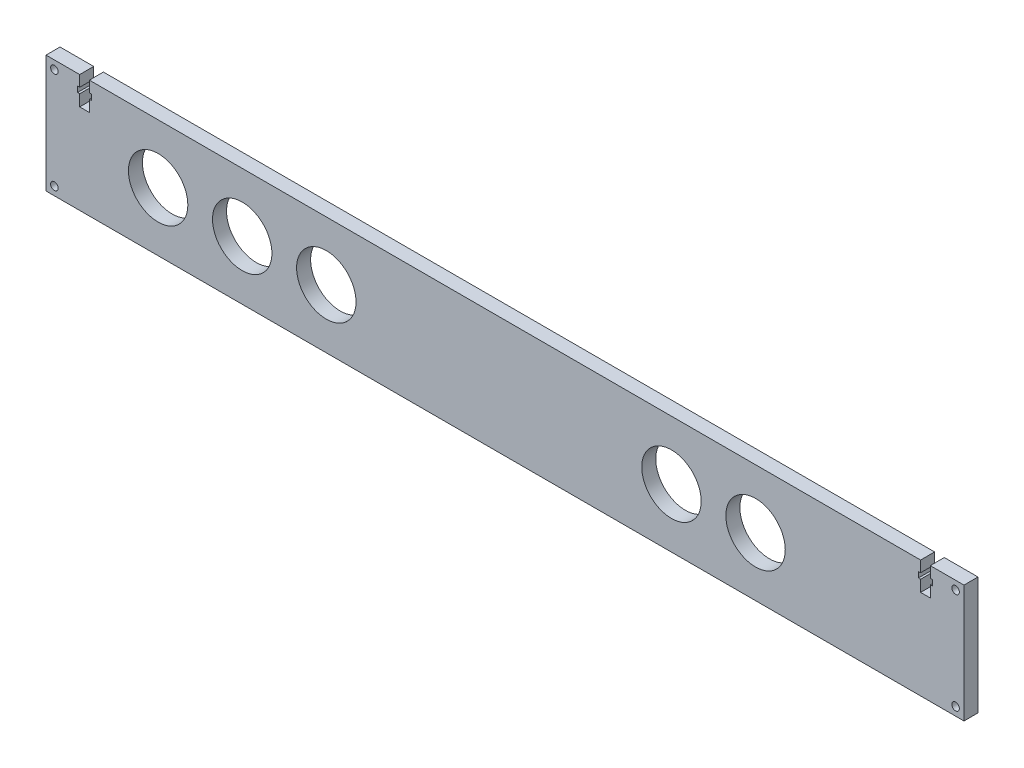
from build123d import *

# Parameters (mm, degrees)
SKETCH1_W                   = 415.925
SKETCH1_H                   = 53.34
BOSS_EXTRUDE1_DEPTH         = 6.35
SKETCH6_R                   = 13.462
CUT_EXTRUDE4_DEPTH          = 502.480799104
F_29_0_136_DIAMETER_HOLE1_D = 3.4544
CUT_EXTRUDE3_DEPTH          = 502.480799104


with BuildPart() as part:
    # Sketch1 → Boss-Extrude1 (new body)
    with BuildSketch(Plane.XY):
        with Locations((-250.890650119, 175.558721987)):
            Rectangle(SKETCH1_W, SKETCH1_H)
    extrude(amount=BOSS_EXTRUDE1_DEPTH)

    # Sketch6 → Cut-Extrude4 (cut, through all)
    with BuildSketch(Plane.XY.offset(6.35)):
        with Locations((-408.053150119, 175.558721987)):
            Circle(SKETCH6_R)
        with Locations((-175.467685368, 175.558721987)):
            Circle(SKETCH6_R)
        with Locations((-369.953150119, 175.558721987)):
            Circle(SKETCH6_R)
        with Locations((-331.853150119, 175.558721987)):
            Circle(SKETCH6_R)
        with Locations((-137.367685368, 175.558721987)):
            Circle(SKETCH6_R)
    extrude(amount=-CUT_EXTRUDE4_DEPTH, mode=Mode.SUBTRACT)

    # #29 (0.136) Diameter Hole1 (through all)
    with Locations(Plane.XY.offset(6.35)):
        with Locations((-455.043150119, 198.418721987), (-455.043150119, 152.698721987), (-46.738150119, 198.418721987), (-46.738150119, 152.698721987)):
            Hole(F_29_0_136_DIAMETER_HOLE1_D / 2)

    # Sketch5 → Cut-Extrude3 (cut, through all)
    with BuildSketch(Plane(origin=(0, 0, 0), x_dir=(-1, 0, 0), z_dir=(0, 0, -1))):
        Polygon((443.587750119, 202.228721987), (439.193550119, 202.228721987), (439.193550119, 197.228096987), (438.215650119, 197.228096987), (438.215650119, 194.688096987), (439.193550119, 194.688096987), (439.193550119, 189.528721987), (443.587750119, 189.528721987), (443.587750119, 194.688096987), (444.565650119, 194.688096987), (444.565650119, 197.228096987), (443.587750119, 197.228096987), align=None)
        Polygon((62.587750119, 202.228721987), (58.193550119, 202.228721987), (58.193550119, 197.228096987), (57.215650119, 197.228096987), (57.215650119, 194.688096987), (58.193550119, 194.688096987), (58.193550119, 189.528721987), (62.587750119, 189.528721987), (62.587750119, 194.688096987), (63.565650119, 194.688096987), (63.565650119, 197.228096987), (62.587750119, 197.228096987), align=None)
    extrude(amount=-CUT_EXTRUDE3_DEPTH, mode=Mode.SUBTRACT)


solid = part.part
